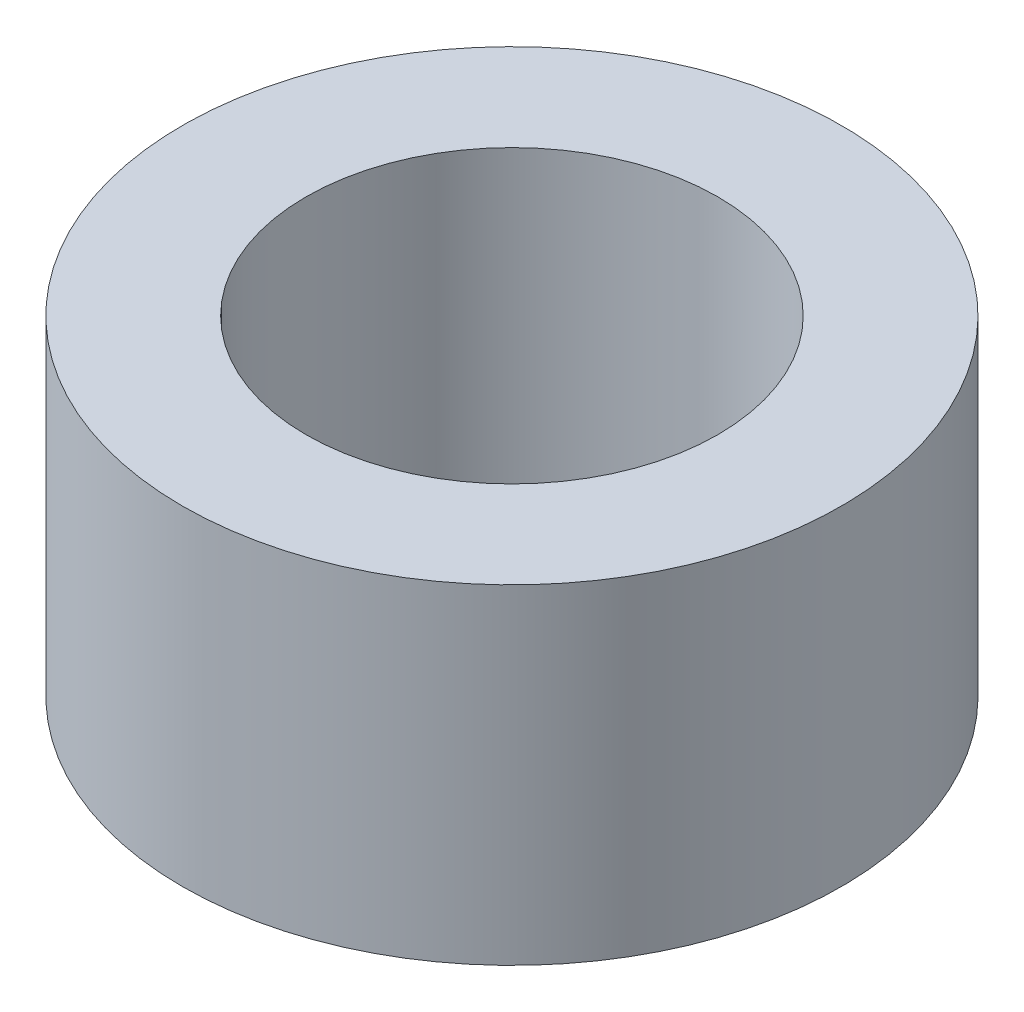
from build123d import *

# Parameters (mm, degrees)
SKETCH1_R           = 5
SKETCH1_R_2         = 3.125
BOSS_EXTRUDE1_DEPTH = 5


with BuildPart() as part:
    # Sketch1 → Boss-Extrude1 (new body)
    with BuildSketch(Plane(origin=(0, 0, 0), x_dir=(1, 0, 0), z_dir=(0, 1, 0))):
        with Locations(Location((0, 0, 0), (0, 0, 270))):
            Circle(SKETCH1_R)
        with Locations(Location((0, 0, 0), (0, 0, 270))):
            Circle(SKETCH1_R_2, mode=Mode.SUBTRACT)
    extrude(amount=BOSS_EXTRUDE1_DEPTH)


solid = part.part
